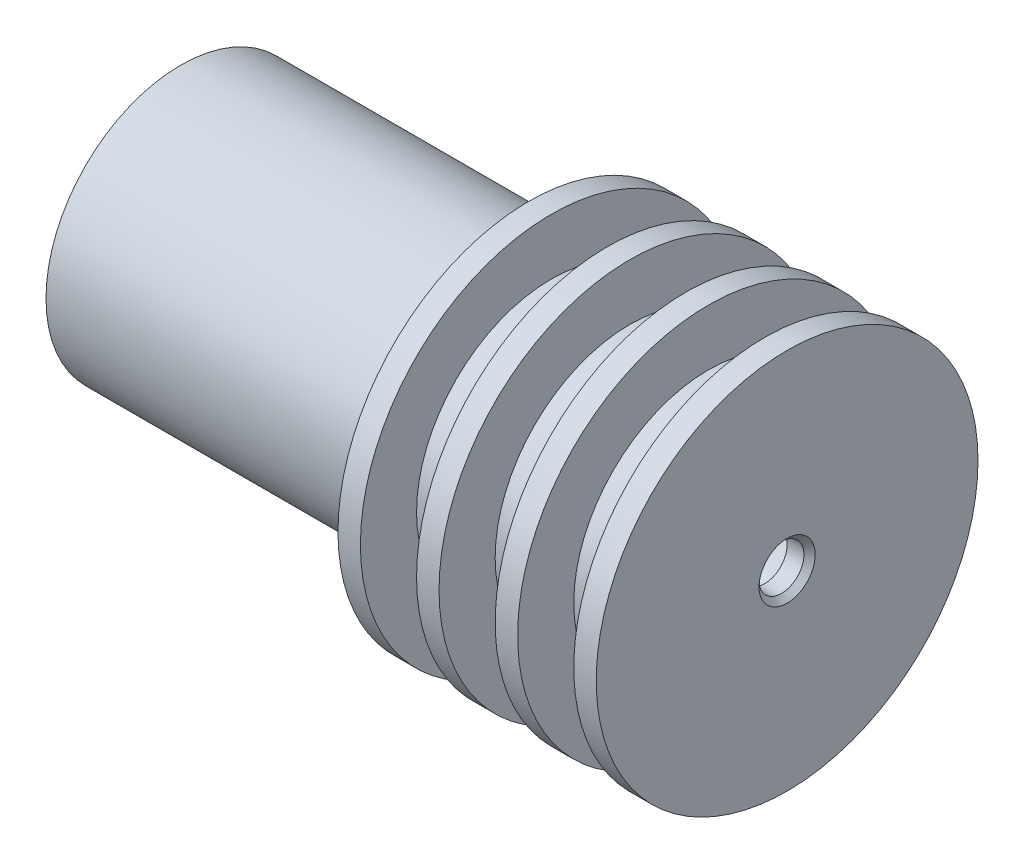
from build123d import *

# Parameters (mm, degrees)
SKETCH_1_W          = 46
SKETCH_1_H          = 2
SKETCH_8_R          = 12
SKETCH_8_R_2        = 10
EXTRUDE_3_DEPTH     = 3
SKETCH_9_R          = 12
EXTRUDE_5_DEPTH     = 5
SKETCH_11_R         = 10
CUT_EXTRUDE_7_DEPTH = 52
SKETCH_12_R         = 2
CUT_EXTRUDE_8_DEPTH = 57.603886792
CHAMFER_1_SIZE      = 0.5
EXTRUDE_START       = -2
SKETCH_14_R         = 17
SKETCH_14_R_2       = 12
EXTRUDE_6_DEPTH     = 2
EXTRUDE_START_2     = -9
SKETCH_15_R         = 17
SKETCH_15_R_2       = 12
EXTRUDE_7_DEPTH     = 2
EXTRUDE_START_3     = 7
SKETCH_20_R         = 17
SKETCH_20_R_2       = 12
EXTRUDE_11_DEPTH    = 2
SKETCH_21_R         = 17
SKETCH_21_R_2       = 10
EXTRUDE_12_DEPTH    = 2


with BuildPart() as part:
    # 草图1 → 旋转1 (revolve)
    with BuildSketch(Plane.XY):
        with Locations((-3, 11)):
            Rectangle(SKETCH_1_W, SKETCH_1_H)
    revolve(axis=Axis((-26, 0, 0), (1, 0, 0)))

    # 草图8 → 凸台-拉伸3 (add)
    with BuildSketch(Plane(origin=(20, 0, 0), x_dir=(0, 0, -1), z_dir=(1, 0, 0))):
        Circle(SKETCH_8_R)
        Circle(SKETCH_8_R_2, mode=Mode.SUBTRACT)
    extrude(amount=EXTRUDE_3_DEPTH)

    # 草图15 → 凸台-拉伸7 (add)
    with BuildSketch(Plane(origin=(28, 0, 0), x_dir=(0, 0, -1), z_dir=(1, 0, 0)).offset(EXTRUDE_START_2)):
        Circle(SKETCH_15_R)
        Circle(SKETCH_15_R_2, mode=Mode.SUBTRACT)
    extrude(amount=EXTRUDE_7_DEPTH)

    # 草图20 → 凸台-拉伸11 (add)
    with BuildSketch(Plane.ZY.offset(-19).offset(EXTRUDE_START_3)):
        Circle(SKETCH_20_R)
        Circle(SKETCH_20_R_2, mode=Mode.SUBTRACT)
    extrude(amount=-EXTRUDE_11_DEPTH)

    # 草图21 → 凸台-拉伸12 (add)
    with BuildSketch(Plane.ZY.offset(-12).offset(EXTRUDE_START_3)):
        Circle(SKETCH_21_R)
        Circle(SKETCH_21_R_2, mode=Mode.SUBTRACT)
    extrude(amount=-EXTRUDE_12_DEPTH)


with BuildPart() as body_2:
    # 草图9 → 凸台-拉伸5 (new body)
    with BuildSketch(Plane(origin=(23, 0, 0), x_dir=(0, 0, -1), z_dir=(1, 0, 0))):
        Circle(SKETCH_9_R)
    extrude(amount=EXTRUDE_5_DEPTH)

    # 草图11 → 切除-拉伸7 (cut)
    with BuildSketch(Plane.ZY.offset(26)):
        Circle(SKETCH_11_R)
    extrude(amount=-CUT_EXTRUDE_7_DEPTH, mode=Mode.SUBTRACT)

    # 草图12 → 切除-拉伸8 (cut, through all)
    with BuildSketch(Plane(origin=(28, 0, 0), x_dir=(0, 0, -1), z_dir=(1, 0, 0))):
        Circle(SKETCH_12_R)
    extrude(amount=-CUT_EXTRUDE_8_DEPTH, mode=Mode.SUBTRACT)

    # 倒角1
    chamfer_1_edges = [body_2.edges().sort_by_distance(p)[0] for p in [
        (28, 0, 2),
    ]]
    chamfer(chamfer_1_edges, length=CHAMFER_1_SIZE)

    # 草图14 → 凸台-拉伸6 (add)
    with BuildSketch(Plane(origin=(28, 0, 0), x_dir=(0, 0, -1), z_dir=(1, 0, 0)).offset(EXTRUDE_START)):
        Circle(SKETCH_14_R)
        Circle(SKETCH_14_R_2, mode=Mode.SUBTRACT)
    extrude(amount=EXTRUDE_6_DEPTH)


solid = Compound([part.part, body_2.part])
